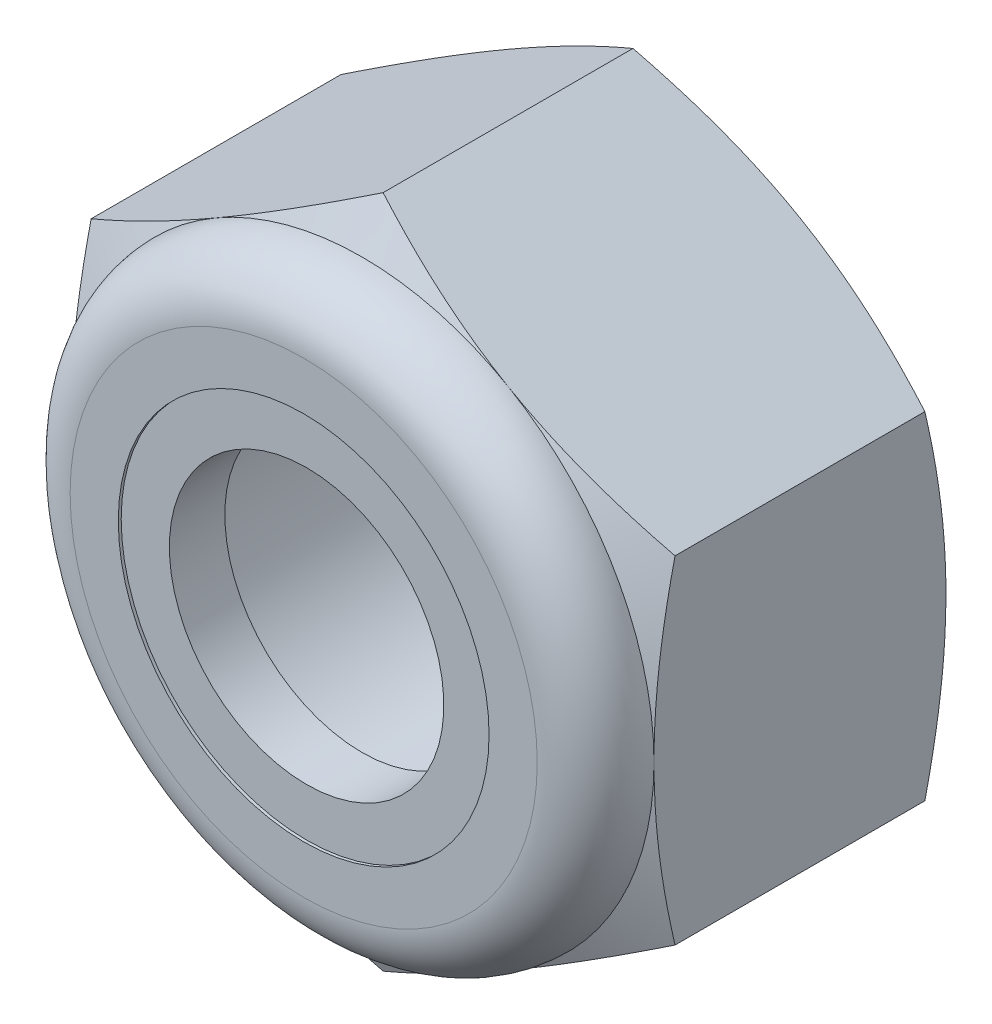
from build123d import *

# Parameters (mm, degrees)
SKETCH3_R           = 3
BOSS_EXTRUDE1_DEPTH = 3


with BuildPart() as part:
    # Sketch3 → Boss-Extrude1 (new, symmetric)
    with BuildSketch(Plane.XY):
        Polygon((0, -5.773502692), (5, -2.886751346), (5, 2.886751346), (0, 5.773502692), (-5, 2.886751346), (-5, -2.886751346), align=None)
        Circle(SKETCH3_R, mode=Mode.SUBTRACT)
    extrude(amount=BOSS_EXTRUDE1_DEPTH, both=True)

    # Sketch4 → Cut-Revolve1 (revolve, cut)
    with BuildSketch(Plane(origin=(0, 0, 0), x_dir=(0, 0, -1), z_dir=(1, 0, 0))):
        with BuildLine():
            Line((4.27, 7.043502692), (-4.27, 7.043502692))
            Line((-4.27, 7.043502692), (-4.27, 4))
            Line((-4.27, 4), (-3, 4))
            ThreePointArc((-3, 4), (-2.707106781, 4.707106781), (-2, 5))
            Line((-2, 5), (-1.639309771, 5.773502692))
            Line((-1.639309771, 5.773502692), (2.639309771, 5.773502692))
            Line((2.639309771, 5.773502692), (3, 5))
            Line((3, 5), (3, 0))
            Line((3, 0), (4.27, 0))
            Line((4.27, 0), (4.27, 7.043502692))
        make_face()
        with BuildLine():
            Line((-4.27, 3.175240474), (-4.27, 0))
            Line((-4.27, 0), (-2, 0))
            Line((-2, 0), (-2, 4.95))
            ThreePointArc((-2, 4.95), (-2.671751442, 4.671751442), (-2.95, 4))
            Line((-2.95, 4), (-2.95, 3.175240474))
            Line((-2.95, 3.175240474), (-4.27, 3.175240474))
        make_face()
    revolve(axis=Axis((0, 0, -3), (0, 0, 1)), mode=Mode.SUBTRACT)


with BuildPart() as body_2:
    # Sketch5 → Revolve1 (revolve)
    with BuildSketch(Plane(origin=(0, 0, 0), x_dir=(0, 0, -1), z_dir=(1, 0, 0))):
        with BuildLine():
            Line((-2.95, 4), (-2.95, 2.350480947))
            Line((-2.95, 2.350480947), (-2, 2.350480947))
            Line((-2, 2.350480947), (-2, 4.95))
            ThreePointArc((-2, 4.95), (-2.671751442, 4.671751442), (-2.95, 4))
        make_face()
    revolve(axis=Axis((0, 0, -3), (0, 0, 1)))


solid = Compound([part.part, body_2.part])
